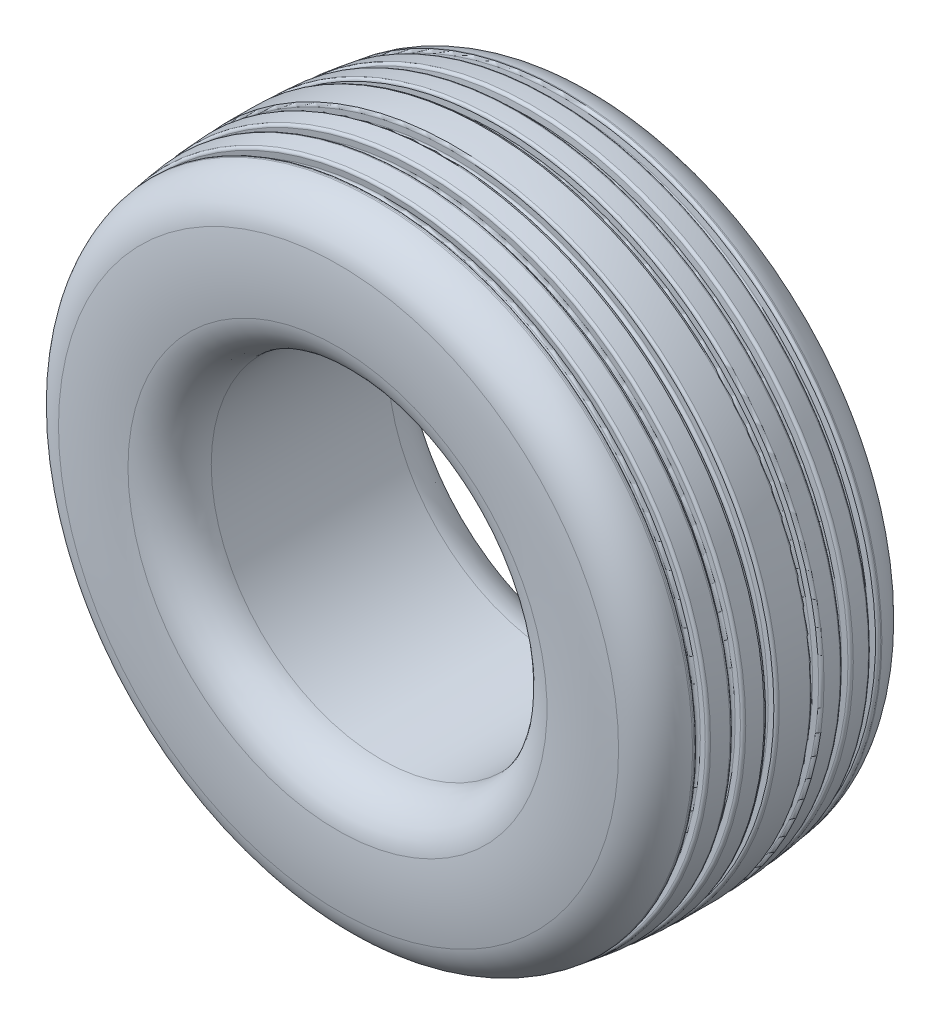
from build123d import *

# Parameters (mm, degrees)
CONG_1_R              = 6
CONG_1_OF_SYM_TRIE1_R = 6
CONG_3_R              = 100


with BuildPart() as part:
    # Esquisse1 → Révolution1 (revolve)
    with BuildSketch(Plane(origin=(0, 0, 0), x_dir=(0, 0, -1), z_dir=(1, 0, 0)), mode=Mode.PRIVATE) as r_volution1_sk:
        with BuildLine():
            Line((-280, 382.94), (280, 382.94))
            ThreePointArc((280, 382.94), (302.085813857, 541.47), (280, 700))
            ThreePointArc((280, 700), (0, 730), (-280, 700))
            ThreePointArc((-280, 700), (-302.085813857, 541.47), (-280, 382.94))
        make_face()
    revolve(r_volution1_sk.sketch.rotate(Axis((0, 0, 600), (0, 0, -1)), 90), axis=Axis((0, 0, 600), (0, 0, -1)))

    # Esquisse4 → Enlèvement de matière-Révolution1 (revolve, cut)
    with BuildSketch(Plane(origin=(0, 0, 0), x_dir=(0, 0, -1), z_dir=(1, 0, 0)), mode=Mode.PRIVATE) as enl_vement_de_mati_re_r_volution1_sk:
        with BuildLine():
            Line((-40, 704.38288657), (-40.771208226, 729.370988496))
            ThreePointArc((-40.771208226, 729.370988496), (-50.965528181, 729.016979297), (-61.156812339, 728.584302688))
            Line((-61.156812339, 728.584302688), (-60, 703.611081326))
            ThreePointArc((-60, 703.611081326), (-50.001489186, 704.035573635), (-40, 704.38288657))
        make_face()
        with BuildLine():
            Line((-110, 700.325765372), (-112.120822622, 725.235645167))
            ThreePointArc((-112.120822622, 725.235645167), (-122.317293643, 724.32773205), (-132.506426735, 723.340871202))
            Line((-132.506426735, 723.340871202), (-130, 698.466832024))
            ThreePointArc((-130, 698.466832024), (-120.003599564, 699.435025895), (-110, 700.325765372))
        make_face()
        with BuildLine():
            Line((-180, 692.445651024), (-183.470437018, 717.203600594))
            ThreePointArc((-183.470437018, 717.203600594), (-193.669124897, 715.733443414), (-203.856041131, 714.183819519))
            Line((-203.856041131, 714.183819519), (-200, 689.482990651))
            ThreePointArc((-200, 689.482990651), (-190.005774489, 691.003302618), (-180, 692.445651024))
        make_face()
    enl_vement_de_mati_re_r_volution1 = revolve(enl_vement_de_mati_re_r_volution1_sk.sketch.rotate(Axis((0, 0, 274.703656999), (0, 0, -1)), 90), axis=Axis((0, 0, 274.703656999), (0, 0, -1)), mode=Mode.SUBTRACT)

    # Congé1
    cong_1_edges = [part.edges().sort_by_distance(p)[0] for p in [
        (-703.611081326, 0, 60),
        (-704.38288657, 0, 40),
        (-729.370988496, 0, 40.771208226),
        (-728.584302688, 0, 61.156812339),
        (-698.466832024, 0, 130),
        (-700.325765372, 0, 110),
        (-725.235645167, 0, 112.120822622),
        (-723.340871202, 0, 132.506426735),
        (-689.482990651, 0, 200),
        (-692.445651024, 0, 180),
        (-717.203600594, 0, 183.470437018),
        (-714.183819519, 0, 203.856041131),
    ]]
    fillet(cong_1_edges, radius=CONG_1_R)

    # Symétrie1: Enlèvement de matière-Révolution1 across plane
    add(enl_vement_de_mati_re_r_volution1.mirror(Plane.XY), mode=Mode.SUBTRACT)

    # Congé1 of Symétrie1
    cong_1_of_sym_trie1_edges = [part.edges().sort_by_distance(p)[0] for p in [
        (-703.611081326, 0, -60),
        (-704.38288657, 0, -40),
        (-729.370988496, 0, -40.771208226),
        (-728.584302688, 0, -61.156812339),
        (-698.466832024, 0, -130),
        (-700.325765372, 0, -110),
        (-725.235645167, 0, -112.120822622),
        (-723.340871202, 0, -132.506426735),
        (-689.482990651, 0, -200),
        (-692.445651024, 0, -180),
        (-717.203600594, 0, -183.470437018),
        (-714.183819519, 0, -203.856041131),
    ]]
    fillet(cong_1_of_sym_trie1_edges, radius=CONG_1_OF_SYM_TRIE1_R)

    # Congé3
    cong_3_edges = [part.edges().sort_by_distance(p)[0] for p in [
        (-700, 0, 280),
        (-700, 0, -280),
        (-382.94, 0, -280),
        (-382.94, 0, 280),
    ]]
    fillet(cong_3_edges, radius=CONG_3_R)


solid = part.part
